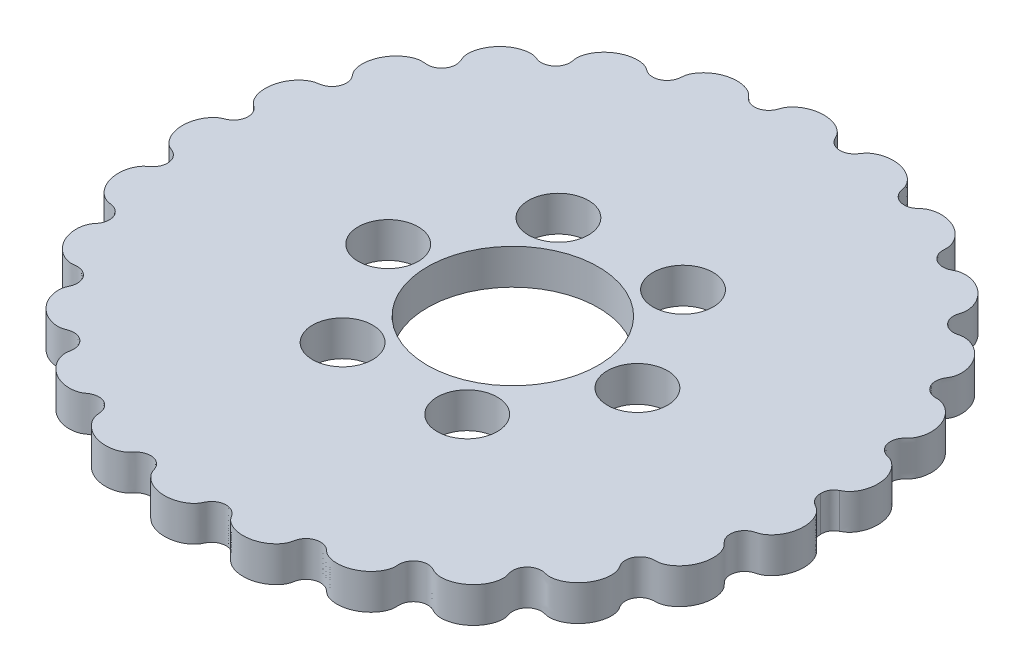
from build123d import *

# Parameters (mm, degrees)
SKETCH4_R           = 3.3655
SKETCH4_R_2         = 9.5758
BOSS_EXTRUDE1_DEPTH = 3.96875


with BuildPart() as part:
    # Sketch4 → Boss-Extrude1 (new body)
    with BuildSketch(Plane(origin=(0, 0, 0), x_dir=(1, 0, 0), z_dir=(0, 1, 0))):
        with BuildLine():
            add(Edge.make_bspline(
                [(34.4805, 0), (34.4805, -0.068301985), (34.490847221, -0.20388815), (34.537467459, -0.490209166), (34.658574916, -0.760626945), (34.845645594, -1.043586986), (35.09368701, -1.296345651), (35.414532137, -1.478366177), (35.75036006, -1.668090565), (36.011194679, -1.940573315), (36.227225363, -2.225850519), (36.438859272, -2.600923223), (36.623260947, -3.066210772), (36.75031745, -3.63796991), (36.779892631, -4.304488578), (36.697238105, -4.965810161), (36.505422029, -5.602434759), (36.244257595, -6.122269327), (35.954261133, -6.526020881), (35.660081728, -6.837215468), (35.382990376, -7.061230899), (35.066110942, -7.263467714), (34.696499548, -7.371165471), (34.34039258, -7.459831058), (34.035883519, -7.638356129), (33.725045859, -7.90299666), (33.453425883, -8.299772196), (33.32137471, -8.765303248), (33.345787988, -9.250399945), (33.478873721, -9.649101049), (33.655924515, -9.968431537), (33.927200465, -10.233660985), (34.215569696, -10.511897954), (34.446360898, -10.918822202), (34.623746205, -11.417431296), (34.71235659, -12.00838143), (34.690141051, -12.667581756), (34.553890967, -13.313947663), (34.312997054, -13.927903824), (33.973174402, -14.493513509), (33.595496625, -14.930610151), (33.218486576, -15.2497235), (32.860436665, -15.478958741), (32.540167132, -15.628900972), (32.187400441, -15.748972001), (31.806516926, -15.770874266), (31.442177889, -15.761282745), (31.103663678, -15.849637028), (30.734868679, -16.01890371), (30.365104547, -16.325805443), (30.109624176, -16.739024246), (30.000694919, -17.21552898), (30.021658477, -17.639840863), (30.108718047, -17.996982733), (30.298697476, -18.327572057), (30.516445453, -18.665729838), (30.644927082, -19.117681538), (30.697061979, -19.647312069), (30.639385572, -20.245763329), (30.455382317, -20.883564938), (30.166320971, -21.473153739), (29.790735203, -21.998266517), (29.340701373, -22.451689897), (28.83102627, -22.817591399), (28.311976321, -23.071238942), (27.812093622, -23.208078241), (27.34538446, -23.261108665), (26.93742808, -23.205603545), (26.569425709, -23.088618703), (26.209214893, -23.084596156), (25.810362882, -23.152261714), (25.379030939, -23.346090909), (25.023870941, -23.672003374), (24.789927791, -24.100415028), (24.69460265, -24.518931064), (24.684307966, -24.888685858), (24.777246706, -25.260695241), (24.91165842, -25.641556242), (24.930094293, -26.113091441), (24.852297294, -26.64285286), (24.650233132, -27.212743022), (24.313368895, -27.790188317), (23.88513662, -28.29446384), (23.386715832, -28.714472057), (22.832539514, -29.044948914), (22.240166114, -29.274582598), (21.67397956, -29.388301295), (21.161723272, -29.394932148), (20.71134685, -29.331270545), (20.34791453, -29.187084816), (19.96555664, -28.953580452), (19.472820186, -28.829520398), (18.892895013, -28.870846462), (18.384915747, -29.125756238), (18.040067558, -29.477470418), (17.832908573, -29.858873298), (17.724754019, -30.214714906), (17.712365918, -30.600542593), (17.754358196, -31.00411891), (17.66110464, -31.468940198), (17.456262031, -31.967293372), (17.120302669, -32.474123067), (16.649099708, -32.954831337), (16.108490431, -33.339611925), (15.5217611, -33.624112585), (14.905639486, -33.807462219), (14.278941644, -33.884979632), (13.706365343, -33.857371198), (13.209669286, -33.741787392), (12.79139073, -33.57211722), (12.469983037, -33.351165633), (12.162846233, -33.029521774), (11.725873395, -32.779034841), (11.15930741, -32.662828402), (10.515963004, -32.78452922), (10.016254116, -33.120369269), (9.69468198, -33.565078781), (9.548221674, -34.015136699), (9.494680317, -34.419542457), (9.293812617, -34.85161691), (8.972626553, -35.288462026), (8.521285248, -35.701078422), (7.942930796, -36.054156178), (7.322532154, -36.295008525), (6.683613231, -36.426367962), (6.043714671, -36.452438492), (5.42089104, -36.375032645), (4.87629343, -36.209727679), (4.423654973, -35.979693632), (4.061639673, -35.715296859), (3.79824672, -35.428690412), (3.584229961, -35.042034084), (3.235290877, -34.68638564), (2.719096871, -34.421031095), (2.061405103, -34.363936342), (1.487538865, -34.556415792), (1.068610996, -34.898737714), (0.811826296, -35.274538371), (0.673824224, -35.623374312), (0.459495129, -35.925100829), (0.198007362, -36.179079027), (-0.159151932, -36.447056788), (-0.629605168, -36.694924455), (-1.219417754, -36.887722966), (-1.901804117, -36.975885262), (-2.56713393, -36.946946295), (-3.198084583, -36.813801361), (-3.779536548, -36.588149034), (-4.263861624, -36.296821623), (-4.646857011, -35.966766922), (-4.931686484, -35.623785124), (-5.125121602, -35.286557563), (-5.232606448, -34.860753977), (-5.470692448, -34.42868106), (-5.890765856, -34.039330061), (-6.495761512, -33.806921651), (-7.100916023, -33.828844723), (-7.610725954, -34.044769507), (-7.979021625, -34.354867413), (-8.220240681, -34.692163079), (-8.598283123, -34.993549229), (-9.095576267, -35.231302254), (-9.694815312, -35.386178489), (-10.38108537, -35.422566394), (-11.045196675, -35.338600764), (-11.670030972, -35.148863085), (-12.24072829, -34.868775333), (-12.746233715, -34.510036556), (-13.142279207, -34.112168441), (-13.433574033, -33.701485356), (-13.62586624, -33.30186757), (-13.73711735, -32.9295385), (-13.736176859, -32.493244481), (-13.847314371, -32.01783547), (-14.149043834, -31.528154755), (-14.676588701, -31.136098939), (-15.280014536, -30.997694131), (-15.842972921, -31.082058193), (-16.282763598, -31.298856515), (-16.603402177, -31.567773974), (-17.04805222, -31.760133072), (-17.586785666, -31.863624839), (-18.201382606, -31.86161323), (-18.867351641, -31.726544462), (-19.477461957, -31.48491567), (-20.020355195, -31.157846067), (-20.488015489, -30.765487858), (-20.87679912, -30.322913807), (-21.166128143, -29.860442777), (-21.363921923, -29.396144831), (-21.468879083, -28.949368384), (-21.503489333, -28.528622338), (-21.410914846, -28.154668538), (-21.377572961, -27.806562532), (-21.423600479, -27.422449086), (-21.577392929, -26.987217246), (-21.932478807, -26.530633994), (-22.473189896, -26.234344641), (-23.042213209, -26.164712344), (-23.527567348, -26.255635525), (-23.907601331, -26.436755249), (-24.301739187, -26.509445243), (-24.682006878, -26.505215154), (-25.122588, -26.446617483), (-25.614149148, -26.302780624), (-26.153399833, -26.045241139), (-26.686946851, -25.659120889), (-27.132687091, -25.208801925), (-27.488316612, -24.714793365), (-27.755283617, -24.193978348), (-27.922136282, -23.677768122), (-28.001637314, -23.18135243), (-27.995419077, -22.723946903), (-27.930121284, -22.306922736), (-27.751958846, -21.967271175), (-27.62807599, -21.642950684), (-27.571370843, -21.265197629), (-27.6022382, -20.807961676), (-27.819511485, -20.274036483), (-28.260405814, -19.84068036), (-28.792925758, -19.620569301), (-29.288592844, -19.576599283), (-29.704543439, -19.656647877), (-30.106491637, -19.638711013), (-30.477277672, -19.540675018), (-30.892846638, -19.377384435), (-31.337302799, -19.116190515), (-31.799675638, -18.73268622), (-32.254274854, -18.188391539), (-32.614391225, -17.552437367), (-32.825405817, -16.930282501), (-32.91648659, -16.356833462), (-32.921857021, -15.87405533), (-32.880928371, -15.489562369), (-32.797057969, -15.148163206), (-32.683439121, -14.850673386), (-32.541112636, -14.606924796), (-32.384263396, -14.41506311), (-32.23010796, -14.220529365), (-32.104631187, -14.006670454), (-32.013233275, -13.775578243), (-31.95702721, -13.533504804), (-31.928115314, -13.155685987), (-32.022178824, -12.647013903), (-32.321491521, -12.16357272), (-32.813891568, -11.816160319), (-33.295123357, -11.669983653), (-33.708040115, -11.646141454), (-34.159880156, -11.486629499), (-34.621860106, -11.196241705), (-35.068000685, -10.779033297), (-35.462378647, -10.228135888), (-35.763325328, -9.596927836), (-35.952787703, -8.898464001), (-36.004208831, -8.249809355), (-35.95272508, -7.675112886), (-35.841423959, -7.208770969), (-35.709686695, -6.84792583), (-35.547470732, -6.53871785), (-35.367632815, -6.278562576), (-35.174088106, -6.075523435), (-34.977833581, -5.926939706), (-34.779805341, -5.779709161), (-34.60232893, -5.609064741), (-34.415731286, -5.363197531), (-34.264478271, -5.052757865), (-34.180609634, -4.679956586), (-34.201268542, -4.167318201), (-34.375761603, -3.698884702), (-34.696902446, -3.307384128), (-35.123563116, -3.033754107), (-35.520809359, -2.908209079), (-35.925925777, -2.647419042), (-36.306118448, -2.250032452), (-36.639747514, -1.734972386), (-36.888426062, -1.100064317), (-37.024757026, -0.416182445), (-37.036998845, 0.300711981), (-36.93130189, 0.932227904), (-36.748524006, 1.465609524), (-36.536065198, 1.88308227), (-36.329521743, 2.196449642), (-36.105512054, 2.457313493), (-35.874440806, 2.669612329), (-35.64138532, 2.828341594), (-35.414247659, 2.935410288), (-35.179968895, 3.026617751), (-34.956963639, 3.140872866), (-34.755010736, 3.291337716), (-34.577443813, 3.469691944), (-34.408974781, 3.700558472), (-34.270000505, 3.990217109), (-34.164773179, 4.43096827), (-34.205731064, 4.932476634), (-34.411902753, 5.396861068), (-34.750959349, 5.779043106), (-35.106984225, 6.000996783), (-35.443107579, 6.349923819), (-35.716938543, 6.831829705), (-35.917054441, 7.414867052), (-36.002758043, 8.095606313), (-35.966876635, 8.793164842), (-35.802230478, 9.490662407), (-35.545601182, 10.074727495), (-35.239891664, 10.544275591), (-34.934264897, 10.895229005), (-34.659762435, 11.147607761), (-34.381394196, 11.345818325), (-34.108078882, 11.495462582), (-33.845970909, 11.595090085), (-33.601826948, 11.646865498), (-33.353682486, 11.675733193), (-33.10970701, 11.725802529), (-32.876255696, 11.815942938), (-32.658522695, 11.939114711), (-32.434490476, 12.115188252), (-32.222148874, 12.356283014), (-32.001017821, 12.752664163), (-31.904310444, 13.249205723), (-31.979059971, 13.75392534), (-32.204859106, 14.216400231), (-32.493559332, 14.524436326), (-32.701471237, 14.867028699), (-32.820677527, 15.232181741), (-32.911100441, 15.668802745), (-32.933189199, 16.184801394), (-32.862438333, 16.781564532), (-32.652185301, 17.457009745), (-32.315867184, 18.100484711), (-31.912509356, 18.611464042), (-31.487604747, 18.996190489), (-31.092136455, 19.262368784), (-30.753166448, 19.437931319), (-30.42869069, 19.555943665), (-30.126817119, 19.625324093), (-29.85458354, 19.649411096), (-29.618448423, 19.63421232), (-29.383703899, 19.601393612), (-29.147250203, 19.59263844), (-28.911376887, 19.620273724), (-28.681660098, 19.680365706), (-28.427686982, 19.787514905), (-28.163126288, 19.959627664), (-27.844629318, 20.279790518), (-27.61600487, 20.734172535), (-27.553309822, 21.242368433), (-27.647017022, 21.752343507), (-27.848837956, 22.126331905), (-27.974022879, 22.509529079), (-28.000845943, 22.895734799), (-27.983305456, 23.343392821), (-27.878125017, 23.851829089), (-27.662438761, 24.415845955), (-27.288822786, 25.024607298), (-26.79624009, 25.572730134), (-26.268073276, 25.972804261), (-25.746860328, 26.24342018), (-25.286167233, 26.400235838), (-24.90280366, 26.485891356), (-24.502633476, 26.509810165), (-24.07484633, 26.492909245), (-23.674740722, 26.321015089), (-23.24672389, 26.18197013), (-22.803024498, 26.189435496), (-22.39409175, 26.293781071), (-21.951313969, 26.546159951), (-21.606627045, 26.925288077), (-21.407946798, 27.407902006), (-21.36707563, 27.935383275), (-21.471851295, 28.360488907), (-21.496629458, 28.77209435), (-21.423965421, 29.156145575), (-21.292026158, 29.584182737), (-21.064915188, 30.044216617), (-20.718321747, 30.530699548), (-20.214004682, 31.018940915), (-19.61626704, 31.419716168), (-19.024142882, 31.67416354), (-18.473830953, 31.809617627), (-18.004802773, 31.856767416), (-17.627472761, 31.852222136), (-17.289333724, 31.805145299), (-16.993488945, 31.727043734), (-16.743146523, 31.625673131), (-16.542228276, 31.506901011), (-16.3545397, 31.367177169), (-16.157987744, 31.240546853), (-15.945097154, 31.143281798), (-15.72024922, 31.077065603), (-15.448907947, 31.037180332), (-15.133197863, 31.046684336), (-14.692141014, 31.155664405), (-14.254813564, 31.430774129), (-13.934346766, 31.843850397), (-13.752746219, 32.344999765), (-13.743671234, 32.785074392), (-13.674352722, 33.193780086), (-13.508653839, 33.550999297), (-13.276427217, 33.93621887), (-12.942014835, 34.328742892), (-12.484936395, 34.717194986), (-11.874663342, 35.06703202), (-11.197260125, 35.308001704), (-10.469418083, 35.423685212), (-9.810778703, 35.398043191), (-9.259241059, 35.276597329), (-8.857076337, 35.115227293), (-8.590282616, 34.969204645), (-8.372096368, 34.81260994), (-8.205345632, 34.651379651), (-8.058381767, 34.471173524), (-7.902806115, 34.298431086), (-7.724981223, 34.148654738), (-7.527227867, 34.025500432), (-7.277283904, 33.914565649), (-6.970802097, 33.838758059), (-6.516129824, 33.82501146), (-6.018859145, 33.973228267), (-5.598307251, 34.287200597), (-5.288100506, 34.724715303), (-5.163403747, 35.149631618), (-5.002738284, 35.534173492), (-4.752417027, 35.842177088), (-4.494033966, 36.101117204), (-4.22122898, 36.311282417), (-3.856927994, 36.537758877), (-3.386670655, 36.750384732), (-2.61137684, 36.96702988), (-1.698992475, 36.994601602), (-0.883036987, 36.815199866), (-0.212879527, 36.481072511), (0.136523205, 36.228775563), (0.359130947, 36.024129758), (0.533162079, 35.821525562), (0.657090946, 35.62704606), (0.755539044, 35.417904558), (0.860216145, 35.211724855), (0.990607891, 35.021009906), (1.147394063, 34.850537993), (1.357895033, 34.677197194), (1.632560631, 34.521930746), (2.067245854, 34.386390943), (2.58796267, 34.395911807), (3.078754828, 34.587124603), (3.496275125, 34.928548386), (3.729836955, 35.307781095), (3.974702398, 35.647849974), (4.295022684, 35.887100827), (4.609489827, 36.076908539), (4.926883842, 36.214781344), (5.337203172, 36.345982147), (5.847593134, 36.437123231), (6.466108739, 36.451963116), (7.175820319, 36.340158857), (7.866122973, 36.096665309), (8.427805421, 35.765106463), (8.851910275, 35.401780675), (9.128595375, 35.074281631), (9.294534156, 34.82355644), (9.414933557, 34.586745355), (9.48973583, 34.369912127), (9.534926464, 34.144554658), (9.582539326, 33.919467231), (9.656756064, 33.702131087), (9.761837388, 33.497182088), (9.917923832, 33.274490379), (10.140709237, 33.051446476), (10.523403384, 32.804071184), (11.029237844, 32.67349075), (11.555037217, 32.727121141), (12.050572806, 32.946888897), (12.377967874, 33.252437262), (12.69549916, 33.52953035), (13.06694115, 33.684666391), (13.419424755, 33.793464552), (13.762469367, 33.850031917), (14.194411216, 33.877151331), (14.713689958, 33.840172088), (15.318238457, 33.702138372), (15.977482903, 33.419159004), (16.586028156, 33.014575347), (17.045150203, 32.558154791), (17.369260349, 32.104830123), (17.577934089, 31.671069401), (17.715458056, 31.276743492), (17.752285921, 30.842016151), (17.692947743, 30.384251554), (17.788651195, 29.966292477), (17.953504166, 29.61686838), (18.222783833, 29.281324519), (18.540258317, 29.044109151), (18.910255585, 28.897071903), (19.302140957, 28.849403595), (19.618403663, 28.873107034), (19.949011287, 28.959250499), (20.268541315, 29.134578636), (20.61427725, 29.310555946), (21.025751852, 29.37887355), (21.477108785, 29.398464691), (21.971769588, 29.334978007), (22.629813824, 29.148732099), (23.301548432, 28.793469311), (23.90837585, 28.292142302), (24.35603862, 27.719951242), (24.610466676, 27.26525154), (24.769656915, 26.862397662), (24.864226721, 26.527543712), (24.915568402, 26.161835536), (24.932498445, 25.759310929), (24.816031435, 25.353713901), (24.678834551, 24.926981856), (24.692223005, 24.484626782), (24.801871806, 24.076210701), (25.061890791, 23.632614447), (25.409756063, 23.327758503), (25.792940381, 23.156498974), (26.158740945, 23.094606553), (26.388753979, 23.087591081), (26.616658474, 23.113784838), (26.84028642, 23.166877759), (27.063307323, 23.221432974), (27.291203461, 23.245335955), (27.556448279, 23.236634484), (27.853573625, 23.192797345), (28.267127165, 23.081413403), (28.775669598, 22.852071934), (29.313971887, 22.484967181), (29.82760988, 21.964057937), (30.230627622, 21.369361348), (30.480325879, 20.803082093), (30.614949762, 20.301912564), (30.670600088, 19.874363298), (30.680682094, 19.528120561), (30.642197631, 19.162549825), (30.561698477, 18.770336695), (30.356213574, 18.404616231), (30.113769194, 18.030460924), (29.983639617, 17.506685909), (30.029873542, 16.880038398), (30.315489785, 16.362992412), (30.713688223, 16.032761937), (31.051082712, 15.874519378), (31.271977346, 15.806184433), (31.49989811, 15.770331454), (31.730819605, 15.763888602), (31.961719857, 15.763472239), (32.190113101, 15.733454341), (32.447090377, 15.661711774), (32.726539095, 15.547079401), (33.102893917, 15.338028586), (33.689435678, 14.873778912), (34.198358814, 14.211967965), (34.561310108, 13.374772785), (34.694968182, 12.580987518), (34.702468299, 12.0645186), (34.652247964, 11.638167995), (34.577884306, 11.3015944), (34.452952904, 10.957500219), (34.280377165, 10.599404256), (33.999018862, 10.291354086), (33.668301769, 9.996084208), (33.405347181, 9.528120091), (33.283229725, 8.913882518), (33.419410806, 8.340783822), (33.714231797, 7.915739526), (33.997334282, 7.672618178), (34.193116156, 7.547085445), (34.404438791, 7.450920091), (34.626920352, 7.384319223), (34.852220921, 7.327860033), (35.068586005, 7.245027691), (35.302596253, 7.113841441), (35.547700208, 6.934344643), (35.795733892, 6.703071609), (36.036083611, 6.415329563), (36.29460226, 6.024918474), (36.537060096, 5.516600142), (36.700197567, 4.952807639), (36.770753394, 4.348490757), (36.756786447, 3.812299541), (36.688780912, 3.351931387), (36.563351747, 2.903587341), (36.4022373, 2.529282438), (36.225767349, 2.228289264), (36.051043869, 1.99515466), (35.896563977, 1.822535721), (35.728893001, 1.670792323), (35.515870134, 1.531428229), (35.355385894, 1.447265193), (35.268172919, 1.39446781), (35.22646995, 1.366585399)],
                knots=[0.066836653, 0.066836653, 0.066836653, 0.066836653, 0.066836653, 0.067842293, 0.068847933, 0.069853572, 0.070859212, 0.072083337, 0.073307461, 0.074531585, 0.07575571, 0.076814382, 0.077873055, 0.0799904, 0.082107745, 0.08422509, 0.086328315, 0.088431541, 0.090534767, 0.09158638, 0.092637993, 0.093859773, 0.095081554, 0.096303334, 0.097525115, 0.098516962, 0.09950881, 0.101492504, 0.103530238, 0.104549105, 0.105567971, 0.106835469, 0.108102966, 0.109370463, 0.11063796, 0.112728819, 0.114819677, 0.116910535, 0.119001394, 0.121090843, 0.123180292, 0.125269741, 0.126314465, 0.127359189, 0.1285706, 0.129782011, 0.130993422, 0.132204833, 0.133190642, 0.134176452, 0.13614807, 0.138211015, 0.139242487, 0.14027396, 0.141545263, 0.142816567, 0.144087871, 0.145359174, 0.147463826, 0.149568478, 0.15167313, 0.153777781, 0.155770372, 0.157762963, 0.159755553, 0.161748144, 0.163054069, 0.164359993, 0.165665917, 0.166971842, 0.16792977, 0.168887697, 0.170803553, 0.17289036, 0.173933764, 0.174977168, 0.176252743, 0.177528319, 0.178803894, 0.18007947, 0.182198001, 0.184316532, 0.186435063, 0.188553595, 0.190569506, 0.192585418, 0.19460133, 0.196617242, 0.197857053, 0.199096865, 0.200336677, 0.201576489, 0.203517719, 0.205458948, 0.207568174, 0.208622787, 0.2096774, 0.210958071, 0.212238743, 0.213519415, 0.214800086, 0.216932206, 0.219064326, 0.221196445, 0.223328565, 0.225331165, 0.227333765, 0.229336366, 0.231338966, 0.232573009, 0.233807052, 0.235041095, 0.236275138, 0.238195314, 0.24011549, 0.242245603, 0.244375716, 0.245662296, 0.246948875, 0.248235455, 0.249522035, 0.251667426, 0.253812818, 0.255958209, 0.258103601, 0.260092956, 0.262082311, 0.264071666, 0.26606102, 0.2672903, 0.26851958, 0.26974886, 0.270978139, 0.272875827, 0.274773514, 0.276967408, 0.279161301, 0.280347095, 0.281532889, 0.282718682, 0.283904476, 0.285026421, 0.286148366, 0.288392257, 0.290636147, 0.292880038, 0.294856168, 0.296832298, 0.298808428, 0.300784558, 0.302010276, 0.303235995, 0.304461713, 0.305687432, 0.307561296, 0.30943516, 0.311584327, 0.313733495, 0.315041172, 0.316348849, 0.317656526, 0.318964203, 0.321137165, 0.323310126, 0.325483088, 0.327656049, 0.329619008, 0.331581967, 0.333544927, 0.335507886, 0.33673089, 0.337953895, 0.339176899, 0.340399903, 0.342248724, 0.344097544, 0.346327906, 0.348558268, 0.349877198, 0.351196128, 0.352515058, 0.353833988, 0.355983632, 0.358133275, 0.360282918, 0.362432562, 0.364298095, 0.366163629, 0.368029162, 0.369894696, 0.371219428, 0.372544159, 0.373868891, 0.375193623, 0.37608563, 0.376977637, 0.378761651, 0.38100767, 0.38325369, 0.384580429, 0.385907169, 0.387233908, 0.388560648, 0.389641615, 0.390722583, 0.392884518, 0.395046452, 0.397208387, 0.399061998, 0.400915608, 0.402769219, 0.404622829, 0.405946533, 0.407270237, 0.40859394, 0.409917644, 0.410795217, 0.41167279, 0.413427936, 0.415687866, 0.417947797, 0.419282725, 0.420617654, 0.421952582, 0.423287511, 0.424374605, 0.4254617, 0.427635889, 0.429810078, 0.431984267, 0.434437324, 0.436890382, 0.438116911, 0.43934344, 0.440569969, 0.441796498, 0.442583912, 0.443371326, 0.44415874, 0.444946153, 0.445733567, 0.446520981, 0.447308395, 0.448095809, 0.450537986, 0.452980163, 0.45428295, 0.455585737, 0.456888525, 0.458191312, 0.460333248, 0.462475184, 0.46461712, 0.466759056, 0.469195824, 0.471632593, 0.472850977, 0.474069361, 0.475287745, 0.47650613, 0.477288578, 0.478071027, 0.478853476, 0.479635925, 0.480418373, 0.481200822, 0.48276572, 0.483991986, 0.485218252, 0.487670784, 0.488982826, 0.490294869, 0.491606911, 0.492918953, 0.495072676, 0.497226398, 0.49938012, 0.501533842, 0.503915063, 0.506296284, 0.507486894, 0.508677504, 0.509868115, 0.511058725, 0.511856051, 0.512653378, 0.513450704, 0.514248031, 0.515045357, 0.515842684, 0.51664001, 0.517437336, 0.518668311, 0.519899285, 0.522361234, 0.523682767, 0.5250043, 0.526325833, 0.527647366, 0.529812455, 0.531977543, 0.534142632, 0.536307721, 0.538673766, 0.541039811, 0.542222833, 0.543405856, 0.544588878, 0.5457719, 0.5465644, 0.5473569, 0.5481494, 0.548941899, 0.549734399, 0.550526899, 0.551319399, 0.552111899, 0.553347156, 0.554582413, 0.557052927, 0.558384121, 0.559715314, 0.561046507, 0.562377701, 0.563465718, 0.564553735, 0.566729769, 0.568905803, 0.571081837, 0.573504009, 0.57592618, 0.577137266, 0.578348352, 0.579559437, 0.580770523, 0.581523039, 0.582275555, 0.58302807, 0.583780586, 0.584533102, 0.585285618, 0.586038133, 0.586790649, 0.588029806, 0.589268963, 0.591747277, 0.59308823, 0.594429182, 0.595770135, 0.597111088, 0.598204367, 0.599297646, 0.601484204, 0.603670762, 0.60585732, 0.608335362, 0.610813404, 0.612052425, 0.613291446, 0.614530466, 0.615769487, 0.617195098, 0.618620709, 0.62004632, 0.621471931, 0.62271834, 0.62396475, 0.626457569, 0.627838747, 0.629219926, 0.630601104, 0.631982282, 0.633063575, 0.634144868, 0.636307453, 0.638470039, 0.640632625, 0.643027833, 0.645423042, 0.646620646, 0.647818251, 0.649015855, 0.650213459, 0.650956261, 0.651699063, 0.652441865, 0.653184667, 0.653927468, 0.65467027, 0.655413072, 0.656155874, 0.657406286, 0.658656699, 0.661157524, 0.66254768, 0.663937835, 0.665327991, 0.666718147, 0.667804313, 0.66889048, 0.671062814, 0.673235148, 0.675407482, 0.677789694, 0.680171907, 0.68255412, 0.683745226, 0.684936332, 0.68567464, 0.686412948, 0.687151256, 0.687889564, 0.688627872, 0.68936618, 0.690104488, 0.690842796, 0.692096581, 0.693350365, 0.695857934, 0.697257368, 0.698656801, 0.700056235, 0.701455668, 0.70254651, 0.703637353, 0.704728195, 0.705819037, 0.708000721, 0.710182406, 0.714921228, 0.71729064, 0.718475345, 0.719660051, 0.720394133, 0.721128214, 0.721862296, 0.722596377, 0.723330459, 0.72406454, 0.724798622, 0.725532703, 0.72678929, 0.728045876, 0.730559049, 0.731967357, 0.733375666, 0.734783974, 0.736192282, 0.737287919, 0.738383556, 0.739479193, 0.74057483, 0.742766104, 0.744957378, 0.74731421, 0.749671042, 0.752027874, 0.75320629, 0.754384707, 0.755114817, 0.755844927, 0.756575038, 0.757305148, 0.758035259, 0.758765369, 0.75949548, 0.76022559, 0.761484477, 0.762743365, 0.765261139, 0.766677873, 0.768094607, 0.76951134, 0.770928074, 0.772028613, 0.773129151, 0.774229689, 0.775330228, 0.777531305, 0.779732381, 0.78207688, 0.784421379, 0.786765878, 0.787938128, 0.789110377, 0.790563146, 0.792015914, 0.793468683, 0.794921451, 0.795915506, 0.79690956, 0.798897669, 0.799900271, 0.800902874, 0.801905476, 0.802908078, 0.804214961, 0.805521844, 0.806828728, 0.808135611, 0.809978986, 0.811822362, 0.815509112, 0.817712047, 0.819914982, 0.821016449, 0.822117916, 0.823219384, 0.824320851, 0.825739239, 0.827157628, 0.828576016, 0.829994405, 0.831253688, 0.832512971, 0.835031536, 0.835760903, 0.836490269, 0.837219636, 0.837949002, 0.838678369, 0.839407735, 0.840137102, 0.840866468, 0.842043674, 0.84322088, 0.845575292, 0.847929703, 0.850284115, 0.852477331, 0.854670547, 0.855767155, 0.856863762, 0.85796037, 0.859056978, 0.860466914, 0.861876849, 0.863286784, 0.864696719, 0.867210862, 0.869725005, 0.870458294, 0.871191582, 0.871924871, 0.87265816, 0.873391449, 0.874124738, 0.874858027, 0.875591316, 0.876774788, 0.877958261, 0.880325205, 0.885059095, 0.887242553, 0.889426012, 0.890517741, 0.891609471, 0.8927012, 0.893792929, 0.895194197, 0.896595465, 0.897996733, 0.899398002, 0.901906746, 0.904415491, 0.905152956, 0.905890421, 0.906627886, 0.907365351, 0.908102816, 0.90884028, 0.909577745, 0.91031521, 0.911505063, 0.912694915, 0.913884767, 0.91507462, 0.917454325, 0.91983403, 0.921311243, 0.922788457, 0.924265671, 0.925742884, 0.927220098, 0.927958705, 0.928697312, 0.929435919, 0.930174525, 0.930913132, 0.931651739, 0.931651739, 0.931651739, 0.931651739, 0.931651739], degree=4))
            add(Edge.make_bspline(
                [(35.22646995, 1.366585399), (34.451993505, 0.963913902), (34.4805, 0)],
                knots=[0, 0, 0, 1, 1, 1], degree=2))
        make_face()
        with Locations(Location((13.97, 0, 0), (0, 0, 270))):
            Circle(SKETCH4_R, mode=Mode.SUBTRACT)
        with Locations(Location((6.985, -12.098374891, 0), (0, 0, 270))):
            Circle(SKETCH4_R, mode=Mode.SUBTRACT)
        with Locations(Location((-6.985, -12.098374891, 0), (0, 0, 270))):
            Circle(SKETCH4_R, mode=Mode.SUBTRACT)
        with Locations(Location((-13.97, 0, 0), (0, 0, 270))):
            Circle(SKETCH4_R, mode=Mode.SUBTRACT)
        with Locations(Location((0, 0, 0), (0, 0, 270))):
            Circle(SKETCH4_R_2, mode=Mode.SUBTRACT)
        with Locations(Location((-6.985, 12.098374891, 0), (0, 0, 270))):
            Circle(SKETCH4_R, mode=Mode.SUBTRACT)
        with Locations(Location((6.985, 12.098374891, 0), (0, 0, 270))):
            Circle(SKETCH4_R, mode=Mode.SUBTRACT)
    extrude(amount=BOSS_EXTRUDE1_DEPTH)


solid = part.part
